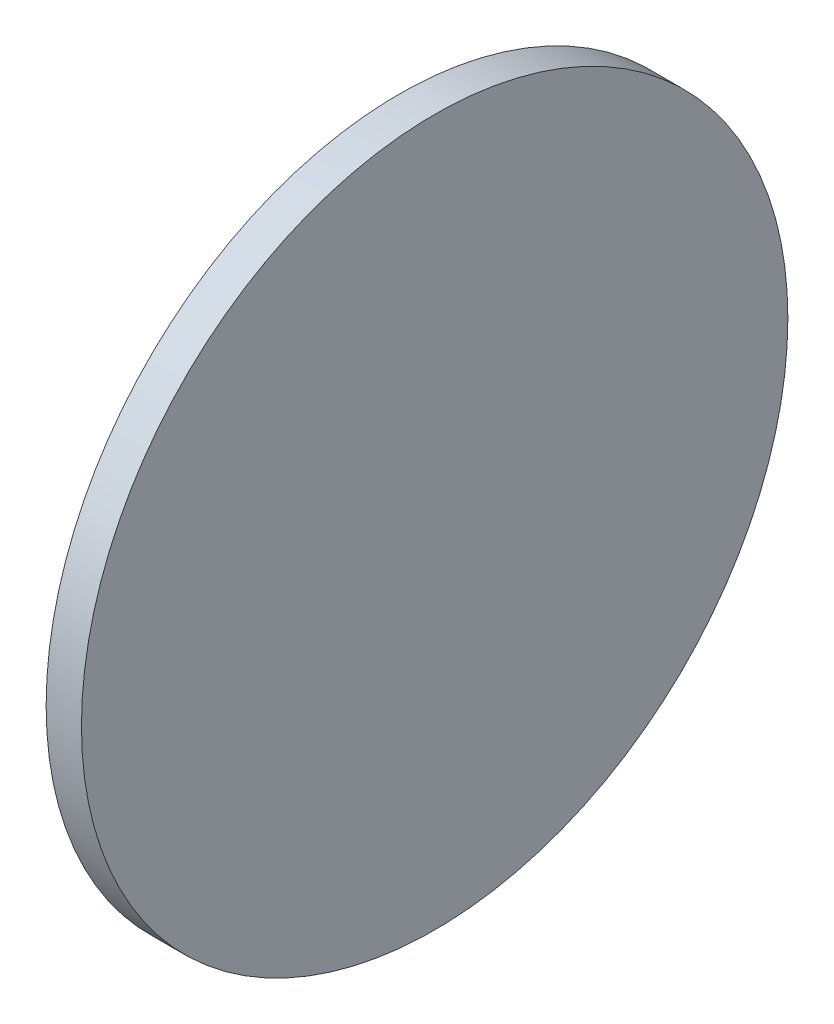
from build123d import *

# Parameters (mm, degrees)
SKETCH1_R           = 25.4
BOSS_EXTRUDE1_DEPTH = 2.54


with BuildPart() as part:
    # Sketch1 → Boss-Extrude1 (new body)
    with BuildSketch(Plane(origin=(0, 0, 0), x_dir=(0, 0, -1), z_dir=(1, 0, 0))):
        Circle(SKETCH1_R)
    extrude(amount=BOSS_EXTRUDE1_DEPTH)


solid = part.part
